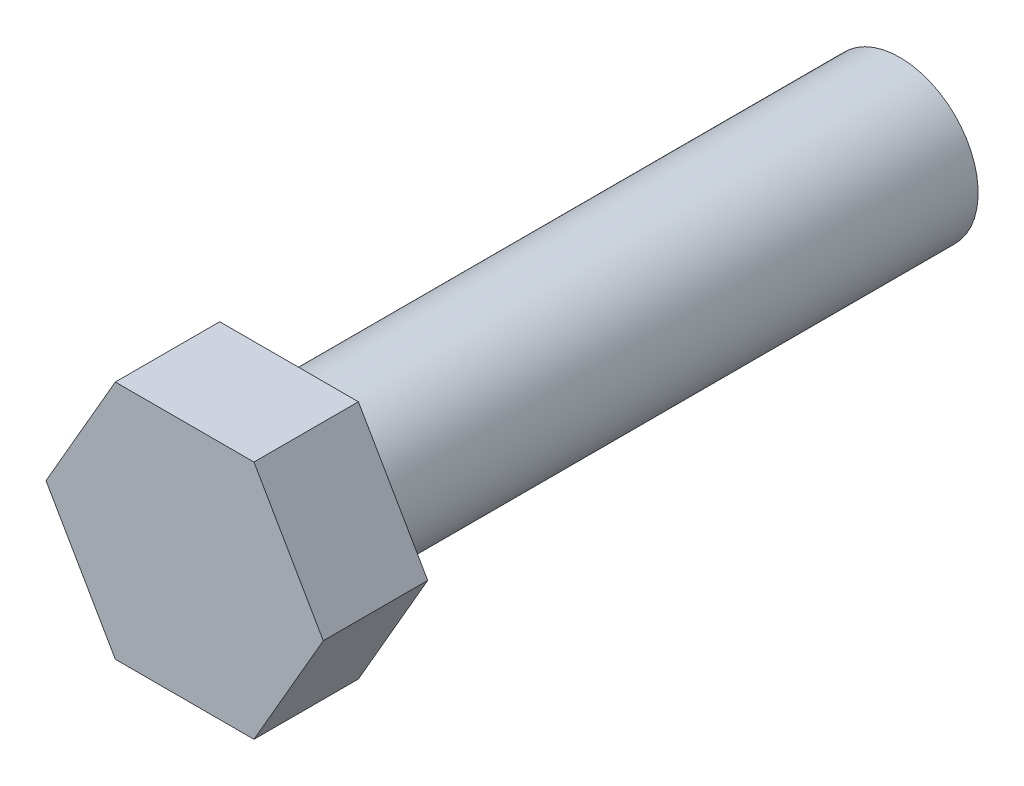
from build123d import *

# Parameters (mm, degrees)
BOSS_EXTRUDE1_DEPTH = 20
SKETCH2_R           = 15
BOSS_EXTRUDE2_DEPTH = 117


with BuildPart() as part:
    # Sketch1 → Boss-Extrude1 (new body)
    with BuildSketch(Plane.XY):
        Polygon((26.558112383, 0), (13.279056191, 23), (-13.279056191, 23), (-26.558112383, 0), (-13.279056191, -23), (13.279056191, -23), align=None)
    extrude(amount=-BOSS_EXTRUDE1_DEPTH)

    # Sketch2 → Boss-Extrude2 (add)
    with BuildSketch(Plane(origin=(0, 0, -20), x_dir=(-1, 0, 0), z_dir=(0, 0, -1))):
        Circle(SKETCH2_R)
    extrude(amount=BOSS_EXTRUDE2_DEPTH)


solid = part.part
